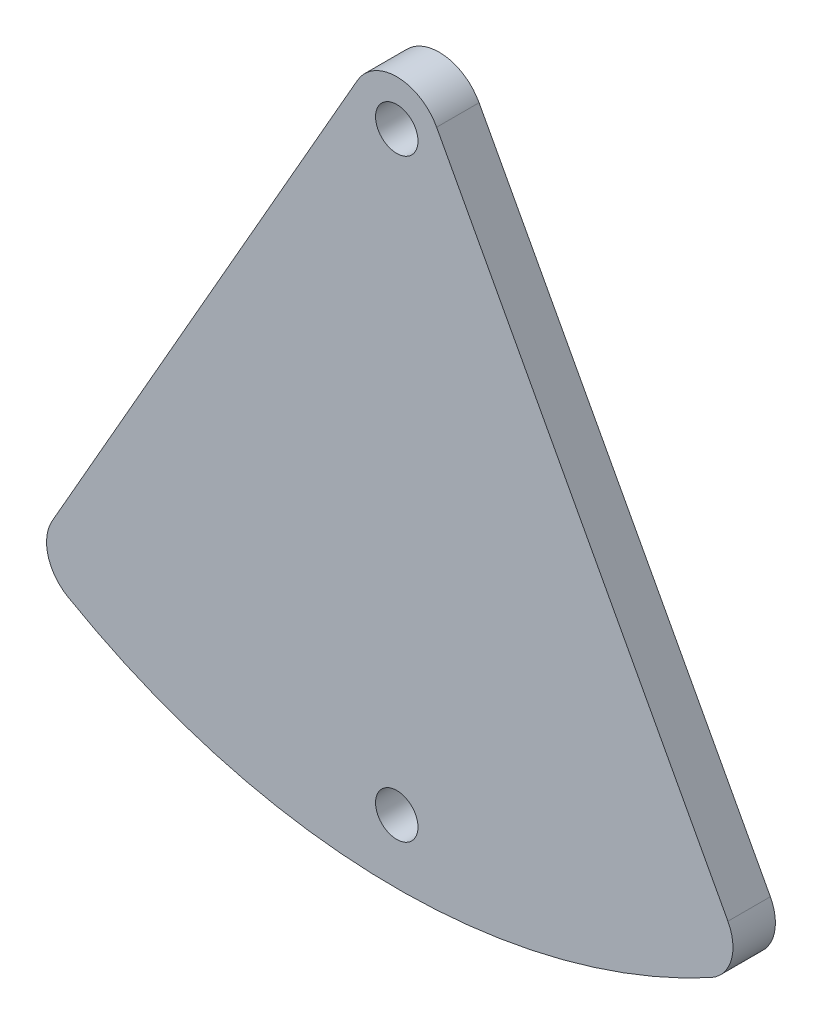
from build123d import *

# Parameters (mm, degrees)
SKETCH1_R          = 5
BASE_EXTRUDE_DEPTH = 5


with BuildPart() as part:
    # Sketch1 → Base-Extrude (new, symmetric)
    with BuildSketch(Plane.XY):
        with BuildLine():
            Line((9.397696336, 105.05059331), (78.039168607, -22.671373759))
            ThreePointArc((78.039168607, -22.671373759), (78.813241725, -30.264373144), (74.00519187, -36.191892476))
            ThreePointArc((74.00519187, -36.191892476), (-2.017468863, -54.986869829), (-77.525144227, -34.21941742))
            ThreePointArc((-77.525144227, -34.21941742), (-82.177273716, -28.168754641), (-81.205819752, -20.598476837))
            Line((-81.205819752, -20.598476837), (-9.263046944, 105.293500781))
            ThreePointArc((-9.263046944, 105.293500781), (0.138865491, 110.667985076), (9.397696336, 105.05059331))
        make_face()
        with Locations((0, -40)):
            Circle(SKETCH1_R, mode=Mode.SUBTRACT)
        with Locations((0, 100)):
            Circle(SKETCH1_R, mode=Mode.SUBTRACT)
    extrude(amount=BASE_EXTRUDE_DEPTH, both=True)


solid = part.part
